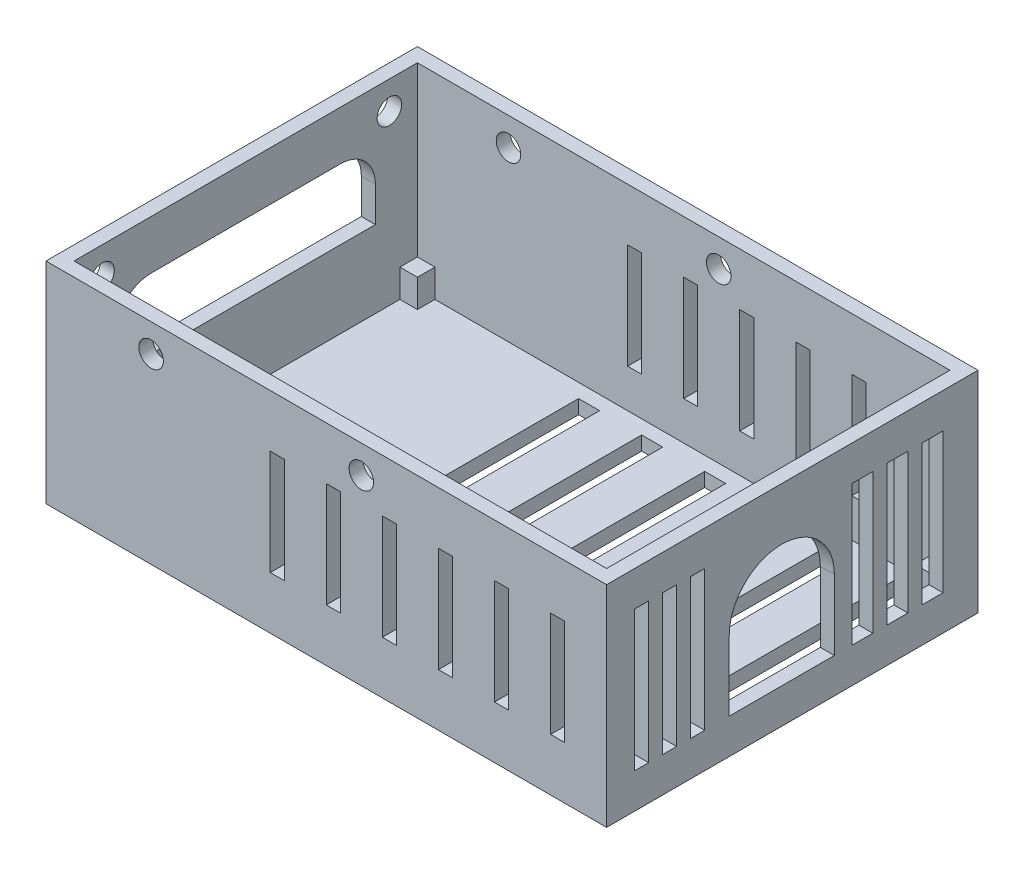
from build123d import *

# Parameters (mm, degrees)
SKETCH1_W           = 80
SKETCH1_H           = 53
BOSS_EXTRUDE1_DEPTH = 30
SKETCH2_W           = 76
SKETCH2_H           = 49
CUT_EXTRUDE1_DEPTH  = 28
CUT_EXTRUDE2_DEPTH  = 6
SKETCH4_W           = 37
SKETCH4_H           = 10
CUT_EXTRUDE3_DEPTH  = 6
SKETCH5_W           = 2.5
SKETCH5_H           = 2.5
STANDOFFS_DEPTH     = 4
FILLET3_R           = 5
FILLET4_R           = 5
SKETCH6_W           = 3
SKETCH6_H           = 45
BOTTOM_GRILL_DEPTH  = 2
CUT_EXTRUDE5_REACH  = 74.863
SKETCH7_W           = 2
SKETCH7_H           = 15
CUT_EXTRUDE6_START  = -53
SKETCH8_R           = 1.75
CUT_EXTRUDE6_DEPTH  = 53
SKETCH9_R           = 1.75
CUT_EXTRUDE7_DEPTH  = 2
SKETCH10_W          = 3
SKETCH10_H          = 20
SKETCH10_W_2        = 2
CUT_EXTRUDE8_DEPTH  = 2


with BuildPart() as part:
    # Sketch1 → Boss-Extrude1 (new body)
    with BuildSketch(Plane(origin=(0, 0, 0), x_dir=(1, 0, 0), z_dir=(0, 1, 0))):
        Rectangle(SKETCH1_W, SKETCH1_H)
    extrude(amount=BOSS_EXTRUDE1_DEPTH)

    # Sketch2 → Cut-Extrude1 (cut)
    with BuildSketch(Plane(origin=(0, 30, 0), x_dir=(1, 0, 0), z_dir=(0, 1, 0))):
        Rectangle(SKETCH2_W, SKETCH2_H)
    extrude(amount=-CUT_EXTRUDE1_DEPTH, mode=Mode.SUBTRACT)

    # Sketch3 → Cut-Extrude2 (cut)
    with BuildSketch(Plane(origin=(40, 0, 0), x_dir=(0, 0, -1), z_dir=(1, 0, 0))):
        with BuildLine():
            Line((6, 15), (6, 5))
            Line((6, 5), (-9, 5))
            Line((-9, 5), (-9, 15))
            ThreePointArc((-9, 15), (-1.5, 22.5), (6, 15))
        make_face()
    extrude(amount=-CUT_EXTRUDE2_DEPTH, mode=Mode.SUBTRACT)

    # Sketch4 → Cut-Extrude3 (cut)
    with BuildSketch(Plane.ZY.offset(40)):
        with Locations((0, 18)):
            Rectangle(SKETCH4_W, SKETCH4_H)
    extrude(amount=-CUT_EXTRUDE3_DEPTH, mode=Mode.SUBTRACT)

    # Sketch5 → Standoffs (add)
    with BuildSketch(Plane(origin=(0, 2, 0), x_dir=(1, 0, 0), z_dir=(0, 1, 0))):
        with Locations((36.75, 23.25)):
            Rectangle(SKETCH5_W, SKETCH5_H)
        with Locations((36.75, -23.25)):
            Rectangle(SKETCH5_W, SKETCH5_H)
        with Locations((-36.75, -23.25)):
            Rectangle(SKETCH5_W, SKETCH5_H)
        with Locations((-36.75, 23.25)):
            Rectangle(SKETCH5_W, SKETCH5_H)
    extrude(amount=STANDOFFS_DEPTH)

    # Fillet3
    fillet3_edges = [part.edges().sort_by_distance(p)[0] for p in [
        (-39, 23, -18.5),
    ]]
    fillet(fillet3_edges, radius=FILLET3_R)

    # Fillet4
    fillet4_edges = [part.edges().sort_by_distance(p)[0] for p in [
        (-39, 23, 18.5),
    ]]
    fillet(fillet4_edges, radius=FILLET4_R)

    # Sketch6 → Bottom Grill (cut)
    with BuildSketch(Plane.XZ):
        with Locations((33.5, 0)):
            Rectangle(SKETCH6_W, SKETCH6_H)
        with Locations((24.5, 0)):
            Rectangle(SKETCH6_W, SKETCH6_H)
        with Locations((15.5, 0)):
            Rectangle(SKETCH6_W, SKETCH6_H)
        with Locations((6.5, 0)):
            Rectangle(SKETCH6_W, SKETCH6_H)
        with Locations((-2.5, 0)):
            Rectangle(SKETCH6_W, SKETCH6_H)
        with Locations((-11.5, 0)):
            Rectangle(SKETCH6_W, SKETCH6_H)
    extrude(amount=-BOTTOM_GRILL_DEPTH, mode=Mode.SUBTRACT)

    # Cut-Extrude5: up to this face of the body (flat: up to its plane)
    cut_extrude5_end = Plane(part.part.faces().sort_by_distance((0, 15, 26.5))[0])
    # Sketch7 → Cut-Extrude5 (cut, up to the picked face)
    with BuildSketch(Plane(origin=(0, 0, -26.5), x_dir=(-1, 0, 0), z_dir=(0, 0, -1)), mode=Mode.PRIVATE) as cut_extrude5_sk1:
        with Locations((-33, 15)):
            Rectangle(SKETCH7_W, SKETCH7_H)
    cut_extrude5_tool1 = split(extrude(cut_extrude5_sk1.sketch, amount=-CUT_EXTRUDE5_REACH, mode=Mode.PRIVATE), bisect_by=cut_extrude5_end, keep=Keep.BOTH, mode=Mode.PRIVATE)
    # Sketch7 → Cut-Extrude5 (cut, up to the picked face)
    with BuildSketch(Plane(origin=(0, 0, -26.5), x_dir=(-1, 0, 0), z_dir=(0, 0, -1)), mode=Mode.PRIVATE) as cut_extrude5_sk2:
        with Locations((-25, 15)):
            Rectangle(SKETCH7_W, SKETCH7_H)
    cut_extrude5_tool2 = split(extrude(cut_extrude5_sk2.sketch, amount=-CUT_EXTRUDE5_REACH, mode=Mode.PRIVATE), bisect_by=cut_extrude5_end, keep=Keep.BOTH, mode=Mode.PRIVATE)
    # Sketch7 → Cut-Extrude5 (cut, up to the picked face)
    with BuildSketch(Plane(origin=(0, 0, -26.5), x_dir=(-1, 0, 0), z_dir=(0, 0, -1)), mode=Mode.PRIVATE) as cut_extrude5_sk3:
        with Locations((-17, 15)):
            Rectangle(SKETCH7_W, SKETCH7_H)
    cut_extrude5_tool3 = split(extrude(cut_extrude5_sk3.sketch, amount=-CUT_EXTRUDE5_REACH, mode=Mode.PRIVATE), bisect_by=cut_extrude5_end, keep=Keep.BOTH, mode=Mode.PRIVATE)
    # Sketch7 → Cut-Extrude5 (cut, up to the picked face)
    with BuildSketch(Plane(origin=(0, 0, -26.5), x_dir=(-1, 0, 0), z_dir=(0, 0, -1)), mode=Mode.PRIVATE) as cut_extrude5_sk4:
        with Locations((-9, 15)):
            Rectangle(SKETCH7_W, SKETCH7_H)
    cut_extrude5_tool4 = split(extrude(cut_extrude5_sk4.sketch, amount=-CUT_EXTRUDE5_REACH, mode=Mode.PRIVATE), bisect_by=cut_extrude5_end, keep=Keep.BOTH, mode=Mode.PRIVATE)
    # Sketch7 → Cut-Extrude5 (cut, up to the picked face)
    with BuildSketch(Plane(origin=(0, 0, -26.5), x_dir=(-1, 0, 0), z_dir=(0, 0, -1)), mode=Mode.PRIVATE) as cut_extrude5_sk5:
        with Locations((-1, 15)):
            Rectangle(SKETCH7_W, SKETCH7_H)
    cut_extrude5_tool5 = split(extrude(cut_extrude5_sk5.sketch, amount=-CUT_EXTRUDE5_REACH, mode=Mode.PRIVATE), bisect_by=cut_extrude5_end, keep=Keep.BOTH, mode=Mode.PRIVATE)
    # Sketch7 → Cut-Extrude5 (cut, up to the picked face)
    with BuildSketch(Plane(origin=(0, 0, -26.5), x_dir=(-1, 0, 0), z_dir=(0, 0, -1)), mode=Mode.PRIVATE) as cut_extrude5_sk6:
        with Locations((7, 15)):
            Rectangle(SKETCH7_W, SKETCH7_H)
    cut_extrude5_tool6 = split(extrude(cut_extrude5_sk6.sketch, amount=-CUT_EXTRUDE5_REACH, mode=Mode.PRIVATE), bisect_by=cut_extrude5_end, keep=Keep.BOTH, mode=Mode.PRIVATE)
    add(cut_extrude5_tool1.solids().sort_by(Axis((33, 15, -26.5), (0, 0, 1)))[0], mode=Mode.SUBTRACT)
    add(cut_extrude5_tool2.solids().sort_by(Axis((25, 15, -26.5), (0, 0, 1)))[0], mode=Mode.SUBTRACT)
    add(cut_extrude5_tool3.solids().sort_by(Axis((17, 15, -26.5), (0, 0, 1)))[0], mode=Mode.SUBTRACT)
    add(cut_extrude5_tool4.solids().sort_by(Axis((9, 15, -26.5), (0, 0, 1)))[0], mode=Mode.SUBTRACT)
    add(cut_extrude5_tool5.solids().sort_by(Axis((1, 15, -26.5), (0, 0, 1)))[0], mode=Mode.SUBTRACT)
    add(cut_extrude5_tool6.solids().sort_by(Axis((-7, 15, -26.5), (0, 0, 1)))[0], mode=Mode.SUBTRACT)

    # Sketch8 → Cut-Extrude6 (cut)
    with BuildSketch(Plane(origin=(0, 0, -26.5), x_dir=(-1, 0, 0), z_dir=(0, 0, -1)).offset(CUT_EXTRUDE6_START)):
        with Locations((-5, 26)):
            Circle(SKETCH8_R)
        with Locations((25, 26)):
            Circle(SKETCH8_R)
    extrude(amount=CUT_EXTRUDE6_DEPTH, mode=Mode.SUBTRACT)

    # Sketch9 → Cut-Extrude7 (cut)
    with BuildSketch(Plane.ZY.offset(40)):
        with Locations((-20.5, 26)):
            Circle(SKETCH9_R)
        with Locations((20.5, 26)):
            Circle(SKETCH9_R)
    extrude(amount=-CUT_EXTRUDE7_DEPTH, mode=Mode.SUBTRACT)

    # Sketch10 → Cut-Extrude8 (cut)
    with BuildSketch(Plane(origin=(40, 0, 0), x_dir=(0, 0, -1), z_dir=(1, 0, 0))):
        with Locations((20, 15)):
            Rectangle(SKETCH10_W, SKETCH10_H)
        with Locations((15, 15)):
            Rectangle(SKETCH10_W, SKETCH10_H)
        with Locations((10, 15)):
            Rectangle(SKETCH10_W, SKETCH10_H)
        with Locations((-21.5, 15)):
            Rectangle(SKETCH10_W_2, SKETCH10_H)
        with Locations((-17.5, 15)):
            Rectangle(SKETCH10_W_2, SKETCH10_H)
        with Locations((-13.5, 15)):
            Rectangle(SKETCH10_W_2, SKETCH10_H)
    extrude(amount=-CUT_EXTRUDE8_DEPTH, mode=Mode.SUBTRACT)


solid = part.part
